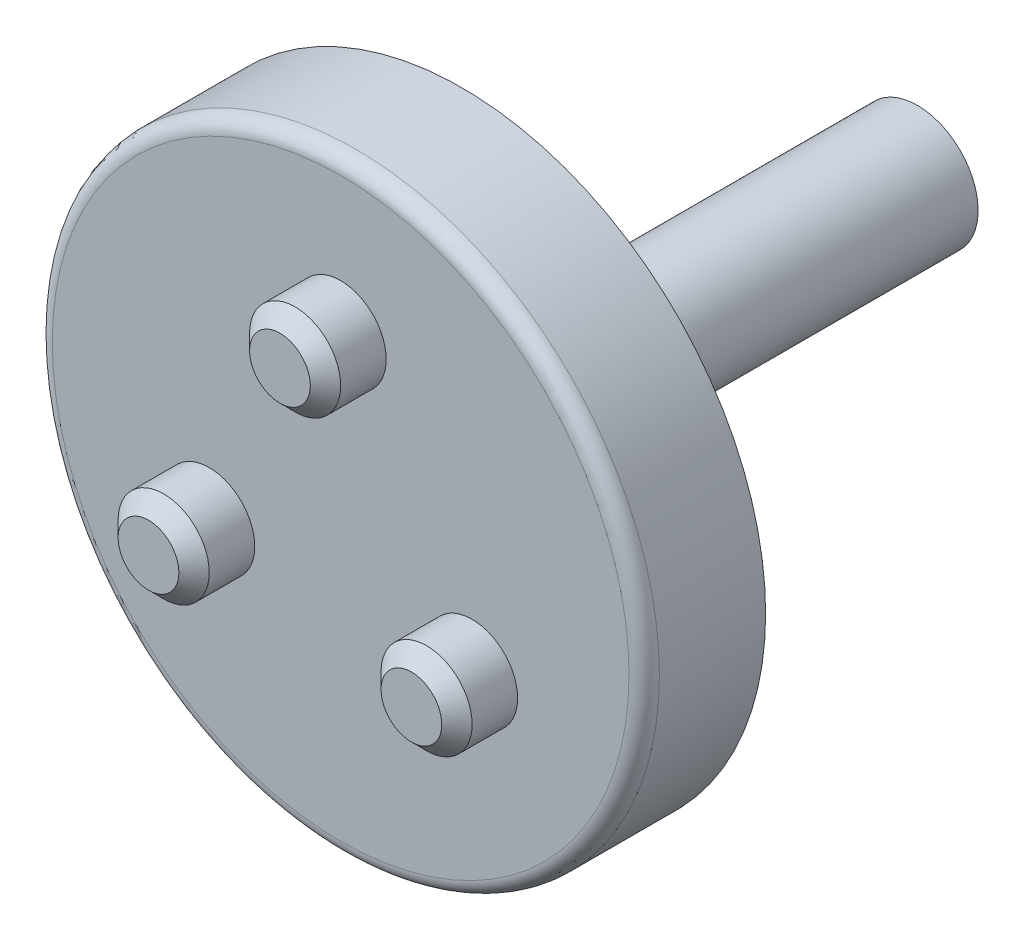
from build123d import *

# Parameters (mm, degrees)
SKETCH1_R           = 100
BOSS_EXTRUDE1_DEPTH = 40
SKETCH2_R           = 15
BOSS_EXTRUDE2_DEPTH = 20
SKETCH3_R           = 20
BOSS_EXTRUDE3_DEPTH = 150
CHAMFER1_SIZE       = 5
FILLET1_R           = 5


with BuildPart() as part:
    # Sketch1 → Boss-Extrude1 (new body)
    with BuildSketch(Plane.XY):
        Circle(SKETCH1_R)
    extrude(amount=BOSS_EXTRUDE1_DEPTH)

    # Sketch2 → Boss-Extrude2 (add)
    with BuildSketch(Plane.XY.offset(40)):
        with Locations((0, 50)):
            Circle(SKETCH2_R)
        with Locations((43.301270189, -25)):
            Circle(SKETCH2_R)
        with Locations((-43.301270189, -25)):
            Circle(SKETCH2_R)
    extrude(amount=BOSS_EXTRUDE2_DEPTH)

    # Chamfer1
    chamfer1_edges = [part.edges().sort_by_distance(p)[0] for p in [
        (-58.301270189, -25, 60),
        (-15, 50, 60),
        (28.301270189, -25, 60),
    ]]
    chamfer(chamfer1_edges, length=CHAMFER1_SIZE)

    # Fillet1
    fillet1_edges = [part.edges().sort_by_distance(p)[0] for p in [
        (-100, 0, 40),
    ]]
    fillet(fillet1_edges, radius=FILLET1_R)


with BuildPart() as body_2:
    # Sketch3 → Boss-Extrude3 (new body)
    with BuildSketch(Plane(origin=(0, 0, 0), x_dir=(-1, 0, 0), z_dir=(0, 0, -1))):
        Circle(SKETCH3_R)
    extrude(amount=BOSS_EXTRUDE3_DEPTH)


solid = Compound([part.part, body_2.part])
